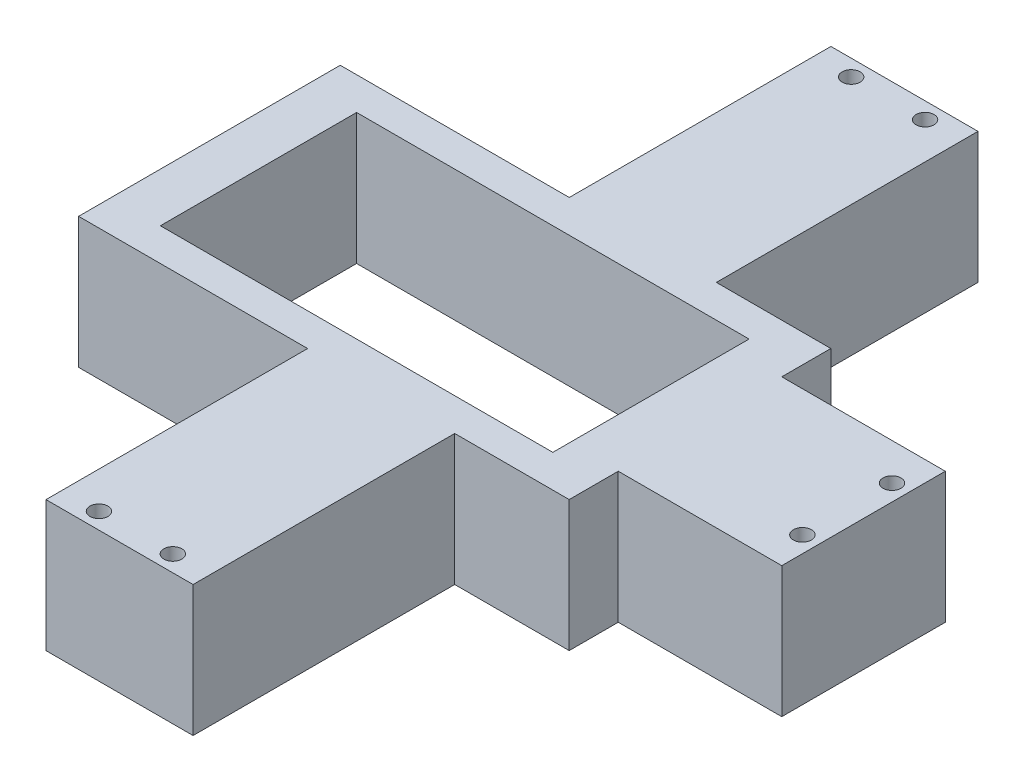
from build123d import *

# Parameters (mm, degrees)
BOSS_EXTRUDE1_DEPTH       = 20
CUT_EXTRUDE1_REACH        = 131.615
SKETCH3_W                 = 60
SKETCH3_H                 = 30
F_1_0MM_DOWEL_HOLE4_D     = 2.75
F_1_0MM_DOWEL_HOLE4_DEPTH = 10
F_1_0MM_DOWEL_HOLE4_TIP   = 0.826183351


with BuildPart() as part:
    # Sketch2 → Boss-Extrude1 (new body)
    with BuildSketch(Plane(origin=(0, 0, 0), x_dir=(1, 0, 0), z_dir=(0, 1, 0))):
        Polygon((57.5, 0), (57.5, -40), (35.013042541, -40), (35.013042541, 0), (0, 0), (0, 40), (35.013042541, 40), (35.013042541, 80), (57.5, 80), (57.5, 40), (75, 40), (75, 32.5), (100, 32.5), (100, 7.5), (75, 7.5), (75, 0), align=None)
    extrude(amount=BOSS_EXTRUDE1_DEPTH)

    # Sketch3 → Cut-Extrude1 (cut, up to next)
    with BuildSketch(Plane(origin=(0, 20, 0), x_dir=(1, 0, 0), z_dir=(0, 1, 0)), mode=Mode.PRIVATE) as cut_extrude1_sk1:
        with Locations((37.5, 20)):
            Rectangle(SKETCH3_W, SKETCH3_H)
    cut_extrude1_tool1 = extrude(cut_extrude1_sk1.sketch, amount=-CUT_EXTRUDE1_REACH, mode=Mode.PRIVATE) & part.part
    add(cut_extrude1_tool1.solids().sort_by_distance((37.5, 20, -20))[0], mode=Mode.SUBTRACT)

    # Ø1.0mm Dowel Hole4
    with Locations(Plane(origin=(0, 20, 0), x_dir=(1, 0, 0), z_dir=(0, 1, 0))):
        with Locations((51.90652127, 77.5), (40.60652127, -37.5), (51.90652127, -37.5), (97.5, 13.15), (97.5, 26.85), (40.60652127, 77.5)):
            Hole(F_1_0MM_DOWEL_HOLE4_D / 2, depth=F_1_0MM_DOWEL_HOLE4_DEPTH)
            with Locations((0, 0, -(F_1_0MM_DOWEL_HOLE4_DEPTH + F_1_0MM_DOWEL_HOLE4_TIP / 2))):  # 118° drill point
                Cone(0, F_1_0MM_DOWEL_HOLE4_D / 2, F_1_0MM_DOWEL_HOLE4_TIP, mode=Mode.SUBTRACT)


solid = part.part
